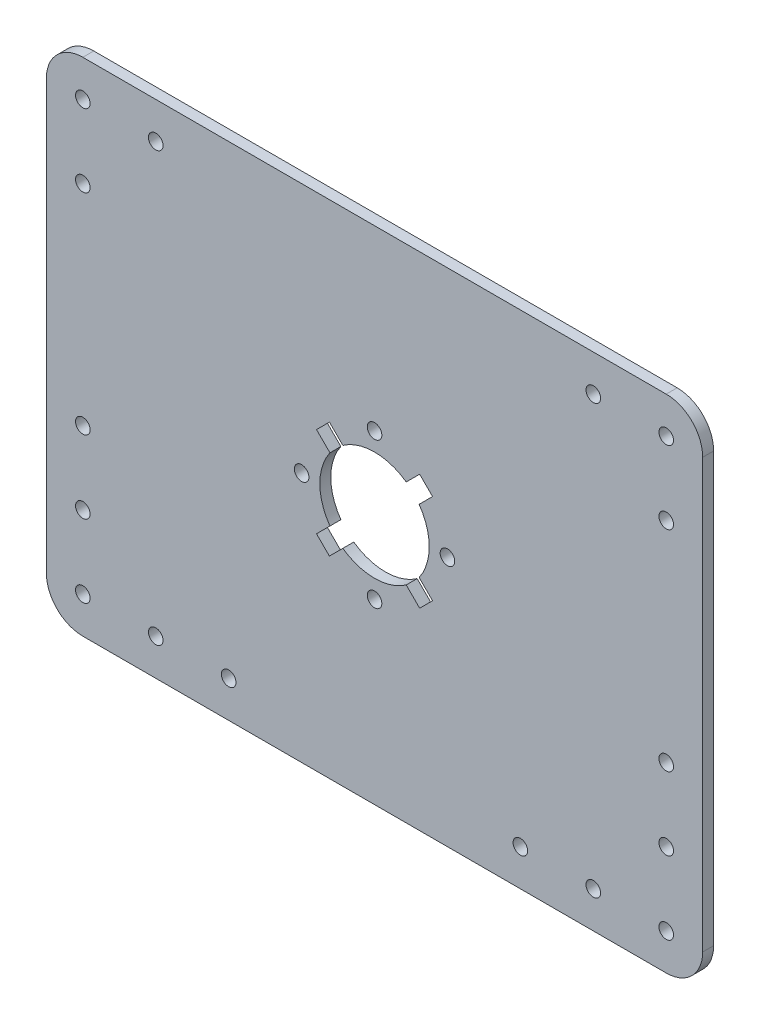
from build123d import *

# Parameters (mm, degrees)
SKETCH_1_R          = 2.0000000000000013
SKETCH_1_R_2        = 2.000000000000003
SKETCH_1_R_3        = 1.9999999999999987
EXTRUDE_1_DEPTH     = 1.5
FILLET_1_R          = 10
SKETCH_3_R          = 1.9999999999999967
SKETCH_3_R_2        = 2.0000000000000036
CUT_EXTRUDE_4_DEPTH = 114.29414150784675


with BuildPart() as part:
    # 草图1 → 凸台-拉伸1 (new, symmetric)
    with BuildSketch(Plane.XY):
        Polygon((-90, -68.75000000000003), (90, -68.75), (90, 68.75), (-90, 68.74999999999997), align=None)
        with Locations((-1.22e-15, -20)):
            Circle(SKETCH_1_R, mode=Mode.SUBTRACT)
        with Locations((-20, 0)):
            Circle(SKETCH_1_R_2, mode=Mode.SUBTRACT)
        with BuildLine():
            Line((-15.909902576697288, 12.374368670764625), (-12.374368670764548, 15.909902576697364))
            Line((-12.374368670764548, 15.909902576697364), (-8.690483378709542, 12.226017284642358))
            ThreePointArc((-8.690483378709553, 12.226017284642344), (5.421e-14, 15.000000000000014), (8.690483378709638, 12.226017284642284))
            Line((8.69048337870963, 12.226017284642296), (12.374368670764623, 15.909902576697288))
            Line((12.374368670764623, 15.909902576697288), (15.909902576697364, 12.37436867076455))
            Line((15.909902576697364, 12.37436867076455), (12.226017284642353, 8.690483378709539))
            ThreePointArc((12.226017284642342, 8.690483378709551), (14.289686127932187, 4.561235618248917), (15, 1.388e-14))
            ThreePointArc((15, 1.02e-14), (14.289686127932162, -4.561235618248962), (12.226017284642253, -8.690483378709645))
            Line((12.226017284642284, -8.690483378709619), (15.909902576697288, -12.374368670764623))
            Line((15.909902576697288, -12.374368670764623), (12.37436867076455, -15.909902576697364))
            Line((12.37436867076455, -15.909902576697364), (8.690483378709526, -12.22601728464234))
            ThreePointArc((8.690483378709535, -12.226017284642328), (-5.605e-14, -14.999999999999986), (-8.690483378709638, -12.226017284642255))
            Line((-8.690483378709613, -12.226017284642284), (-12.374368670764621, -15.909902576697291))
            Line((-12.374368670764621, -15.909902576697291), (-15.90990257669736, -12.374368670764552))
            Line((-15.90990257669736, -12.374368670764552), (-12.22601728464234, -8.69048337870953))
            ThreePointArc((-12.226017284642326, -8.690483378709544), (-15, 5.568e-14), (-12.226017284642273, 8.690483378709645))
            Line((-12.226017284642293, 8.69048337870963), (-15.909902576697288, 12.374368670764625))
        make_face(mode=Mode.SUBTRACT)
        with Locations((20, 2.45e-15)):
            Circle(SKETCH_1_R_2, mode=Mode.SUBTRACT)
        with Locations((-1.22e-15, 20)):
            Circle(SKETCH_1_R_3, mode=Mode.SUBTRACT)
    extrude(amount=EXTRUDE_1_DEPTH, both=True)

    # 圆角1
    fillet_1_edges = [part.edges().sort_by_distance(p)[0] for p in [
        (-90, 68.74999999999997, 0),
        (90, 68.75, 0),
        (90, -68.75, 0),
        (-90, -68.75000000000003, 0),
    ]]
    fillet(fillet_1_edges, radius=FILLET_1_R)

    # 草图3 → 切除-拉伸4 (cut, through all)
    with BuildSketch(Plane.XY.offset(1.5)):
        with Locations((-80, -58.75000000000001)):
            Circle(SKETCH_3_R)
        with Locations((-60, -58.75000000000001)):
            Circle(SKETCH_3_R)
        with Locations((-80.00000000000001, -38.75000000000001)):
            Circle(SKETCH_3_R)
        with Locations((-39.99999999999999, -58.75000000000001)):
            Circle(SKETCH_3_R_2)
        with Locations((-80.00000000000001, -18.750000000000007)):
            Circle(SKETCH_3_R)
        with Locations(Location((80.00000000000004, -38.749999999999986, 0), (0, 0, 180))):
            Circle(SKETCH_3_R)
        with Locations(Location((60.00000000000004, -58.75, 0), (0, 0, 180))):
            Circle(SKETCH_3_R)
        with Locations(Location((80.00000000000003, -58.749999999999986, 0), (0, 0, 180))):
            Circle(SKETCH_3_R)
        with Locations((80.00000000000003, 58.749999999999986)):
            Circle(SKETCH_3_R)
        with Locations((60.00000000000004, 58.75)):
            Circle(SKETCH_3_R)
        with Locations((80.00000000000004, 38.749999999999986)):
            Circle(SKETCH_3_R)
        with Locations(Location((-80.00000000000001, 38.75000000000001, 0), (0, 0, 180))):
            Circle(SKETCH_3_R)
        with Locations(Location((-60, 58.75000000000001, 0), (0, 0, 180))):
            Circle(SKETCH_3_R)
        with Locations(Location((-80, 58.75000000000001, 0), (0, 0, 180))):
            Circle(SKETCH_3_R)
        with Locations(Location((39.99999999999999, -58.75000000000001, 0), (0, 0, 180))):
            Circle(SKETCH_3_R_2)
        with Locations(Location((80.00000000000001, -18.750000000000007, 0), (0, 0, 180))):
            Circle(SKETCH_3_R)
    extrude(amount=-CUT_EXTRUDE_4_DEPTH, mode=Mode.SUBTRACT)


solid = part.part
